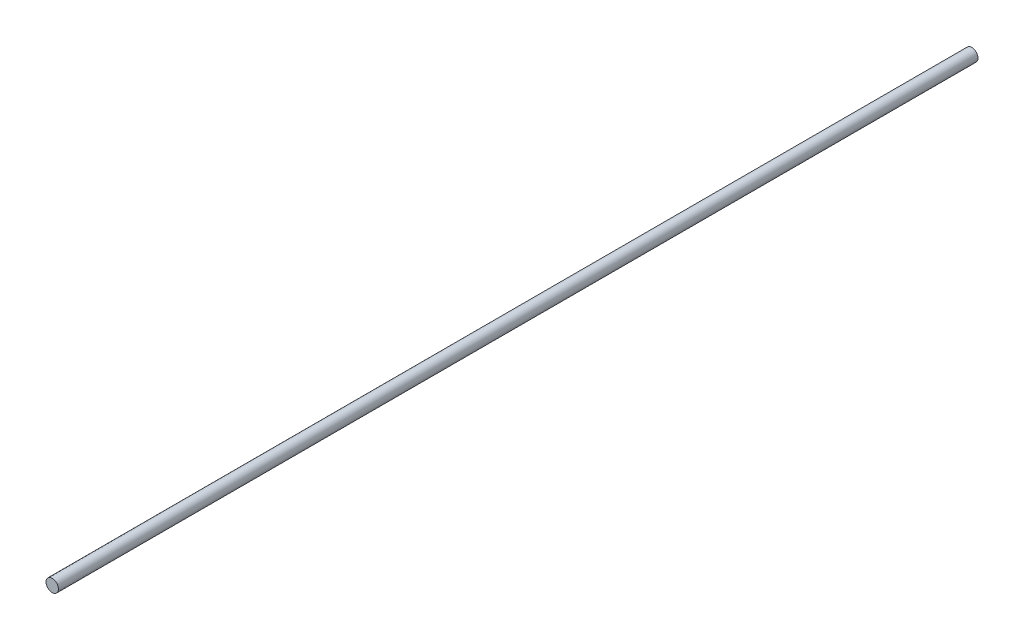
from build123d import *

# Parameters (mm, degrees)
CROQUIS1_R              = 4.05
SALIENTE_EXTRUIR1_DEPTH = 600


with BuildPart() as part:
    # Croquis1 → Saliente-Extruir1 (new body)
    with BuildSketch(Plane.XY):
        Circle(CROQUIS1_R)
    extrude(amount=SALIENTE_EXTRUIR1_DEPTH)


solid = part.part
